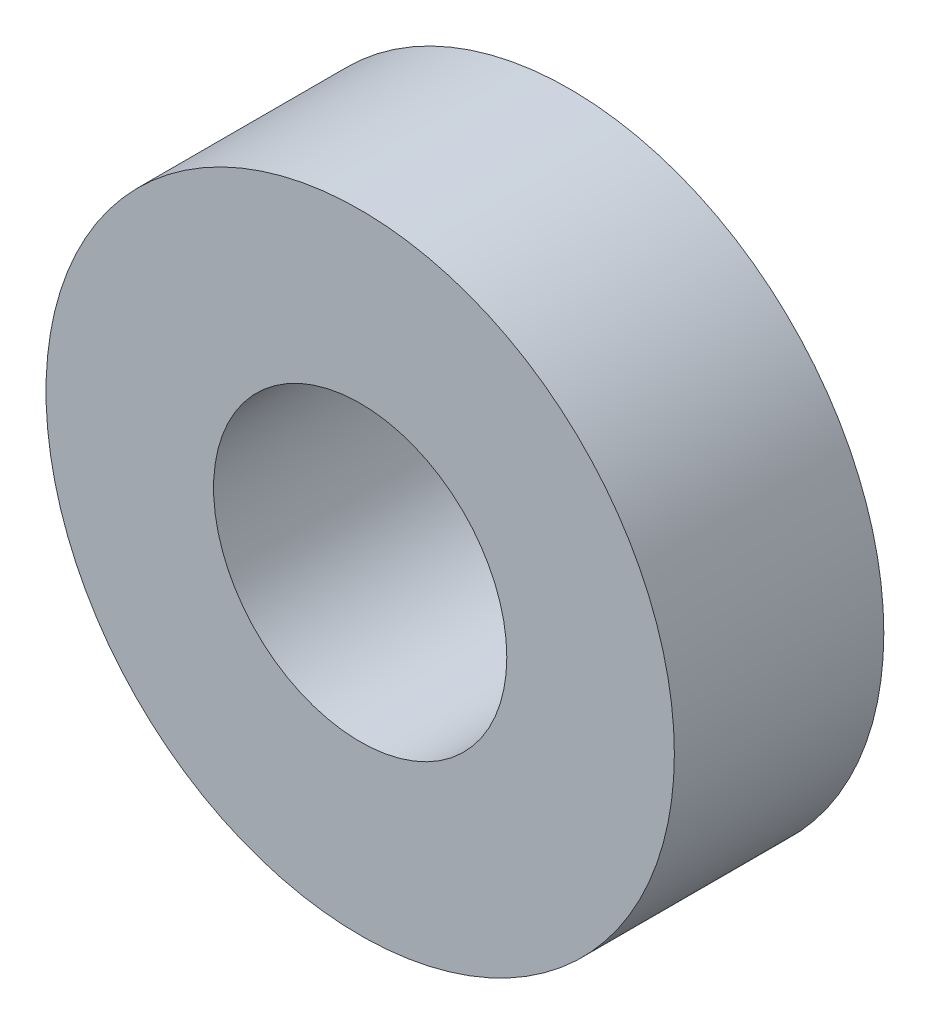
from build123d import *

# Parameters (mm, degrees)
SKETCH1_R           = 15
SKETCH1_R_2         = 7
BOSS_EXTRUDE1_DEPTH = 10
SCALE1_SCALE        = 2.3


with BuildPart() as part:
    # Sketch1 → Boss-Extrude1 (new body)
    with BuildSketch(Plane.XY):
        Circle(SKETCH1_R)
        Circle(SKETCH1_R_2, mode=Mode.SUBTRACT)
    extrude(amount=BOSS_EXTRUDE1_DEPTH)


with BuildPart() as part_1:
    # Scale1: scaled about (0, 0, 5)
    add(part.part.scale(SCALE1_SCALE).moved(Location((0, 0, -6.5))))


solid = part_1.part
